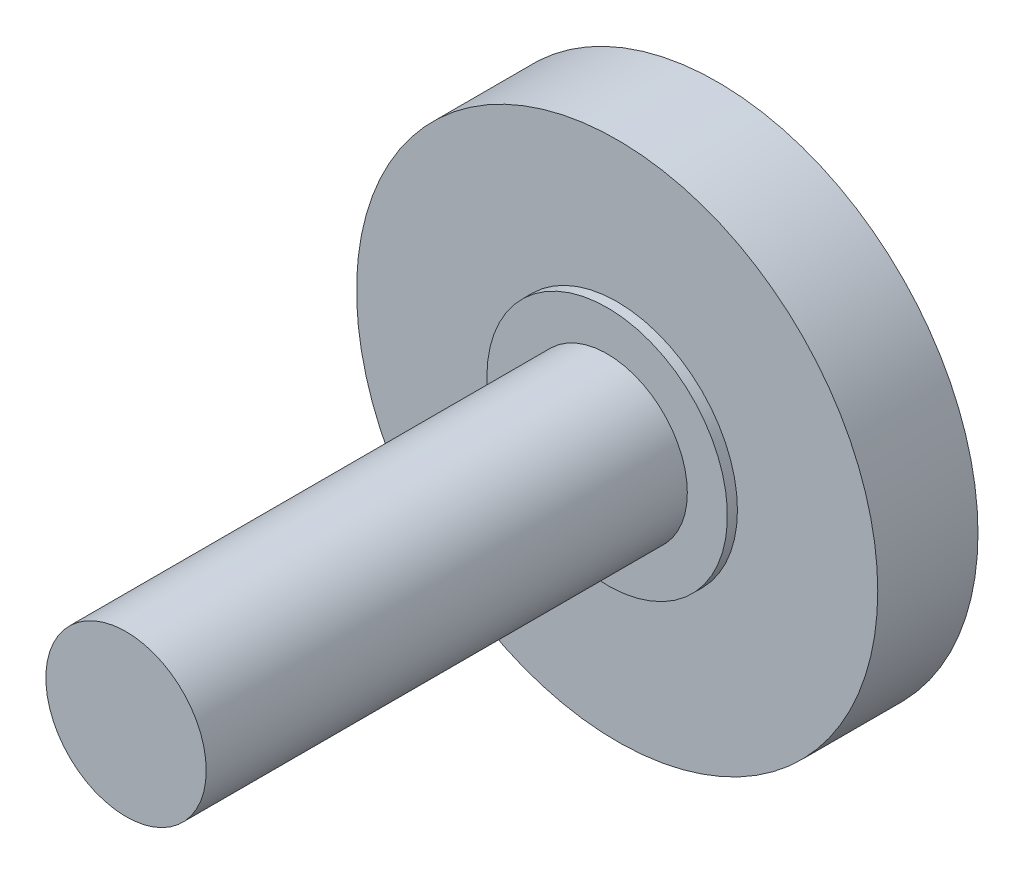
from build123d import *

# Parameters (mm, degrees)
SKETCH1_R           = 13
BOSS_EXTRUDE1_DEPTH = 5
SKETCH12_R          = 4
CUT_EXTRUDE6_DEPTH  = 5
SKETCH13_R          = 6
BOSS_EXTRUDE7_DEPTH = 0.5
CUT_EXTRUDE7_START  = -0.5
SKETCH14_R          = 4
CUT_EXTRUDE7_DEPTH  = 0.5
BOSS_EXTRUDE8_DEPTH = 3
BOSS_EXTRUDE9_START = 30
SKETCH16_R          = 4
BOSS_EXTRUDE9_DEPTH = 30


with BuildPart() as part:
    # Sketch1 → Boss-Extrude1 (new body)
    with BuildSketch(Plane.XY):
        Circle(SKETCH1_R)
    extrude(amount=BOSS_EXTRUDE1_DEPTH)

    # Sketch12 → Cut-Extrude6 (cut)
    with BuildSketch(Plane.XY.offset(5)):
        Circle(SKETCH12_R)
    extrude(amount=-CUT_EXTRUDE6_DEPTH, mode=Mode.SUBTRACT)

    # Sketch13 → Boss-Extrude7 (add)
    with BuildSketch(Plane(origin=(0, 0, 0), x_dir=(-1, 0, 0), z_dir=(0, 0, -1))):
        with Locations(Location((0, 0, 0), (0, 0, 180))):
            Circle(SKETCH13_R)
    boss_extrude7 = extrude(amount=BOSS_EXTRUDE7_DEPTH)

    # Sketch14 → Cut-Extrude7 (cut)
    with BuildSketch(Plane(origin=(0, 0, -0.5), x_dir=(-1, 0, 0), z_dir=(0, 0, -1)).offset(CUT_EXTRUDE7_START)):
        with Locations(Location((0, 0, 0), (0, 0, 180))):
            Circle(SKETCH14_R)
    cut_extrude7 = extrude(amount=CUT_EXTRUDE7_DEPTH, mode=Mode.SUBTRACT)

    # Mirror2: Boss-Extrude7, Cut-Extrude7 across plane
    add(boss_extrude7.mirror(Plane(origin=(0, 0, 2.5), x_dir=(1, 0, 0), z_dir=(0, 0, -1))))
    add(cut_extrude7.mirror(Plane(origin=(0, 0, 2.5), x_dir=(1, 0, 0), z_dir=(0, 0, -1))), mode=Mode.SUBTRACT)

    # Sketch15 → Boss-Extrude8 (add)
    with BuildSketch(Plane(origin=(0, 0, -0.5), x_dir=(-1, 0, 0), z_dir=(0, 0, -1))):
        Polygon((5.743830787, 4.094007051), (-0.673598715, 7.021306902), (-6.417429503, 2.927299852), (-5.743830787, -4.094007051), (0.673598715, -7.021306902), (6.417429503, -2.927299852), align=None)
    extrude(amount=BOSS_EXTRUDE8_DEPTH)

    # Sketch16 → Boss-Extrude9 (add)
    with BuildSketch(Plane.XY.offset(-0.5).offset(BOSS_EXTRUDE9_START)):
        Circle(SKETCH16_R)
    extrude(amount=-BOSS_EXTRUDE9_DEPTH)


solid = part.part
